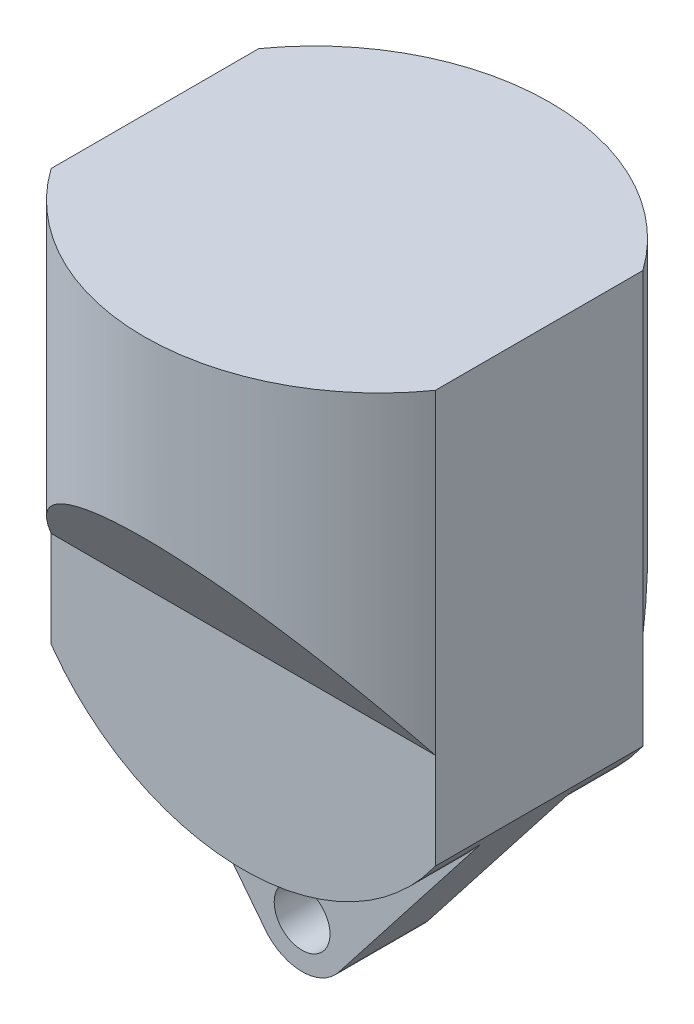
from build123d import *

# Parameters (mm, degrees)
EXTRUDE_1_DEPTH     = 67
SKETCH_2_OUTSIDE_W  = 175.426
SKETCH_2_OUTSIDE_H  = 254.426
CUT_EXTRUDE_1_DEPTH = 19
SKETCH_4_OUTSIDE_W  = 175.426
SKETCH_4_OUTSIDE_H  = 254.426
CUT_EXTRUDE_2_DEPTH = 19
EXTRUDE_2_DEPTH     = 102
CUT_EXTRUDE_3_DEPTH = 247.010162392
SKETCH_7_R          = 9
CUT_EXTRUDE_4_DEPTH = 214.513465618


with BuildPart() as part:
    # Эскиз1 → Бобышка-Вытянуть1 (new body)
    with BuildSketch(Plane.XY):
        with BuildLine():
            Line((-62, 55), (-62, 188))
            Line((-62, 188), (62, 188))
            Line((62, 188), (62, 55))
            Line((62, 55), (12.047963129, -8.935691604))
            ThreePointArc((12.047963129, -8.935691604), (0, -15), (-12.047963129, -8.935691604))
            Line((-12.047963129, -8.935691604), (-62, 55))
        make_face()
    extrude(amount=EXTRUDE_1_DEPTH)

    # Эскиз2 outside → Вырез-Вытянуть1 (cut)
    with BuildSketch(Plane.XY.offset(67)):
        with Locations((0, 86.5)):
            Rectangle(SKETCH_2_OUTSIDE_W, SKETCH_2_OUTSIDE_H)
        with BuildLine():
            Line((-62, 55), (-62, 188))
            Line((-62, 188), (62, 188))
            Line((62, 188), (62, 55))
            ThreePointArc((62, 55), (0, 23), (-62, 55))
        make_face(mode=Mode.SUBTRACT)
    extrude(amount=-CUT_EXTRUDE_1_DEPTH, mode=Mode.SUBTRACT)

    # Эскиз4 outside → Вырез-Вытянуть2 (cut)
    with BuildSketch(Plane(origin=(0, 0, 0), x_dir=(-1, 0, 0), z_dir=(0, 0, -1))):
        with Locations((0, 86.5)):
            Rectangle(SKETCH_4_OUTSIDE_W, SKETCH_4_OUTSIDE_H)
        with BuildLine():
            Line((-62, 55), (-62, 188))
            Line((-62, 188), (62, 188))
            Line((62, 188), (62, 55))
            ThreePointArc((62, 55), (0, 23), (-62, 55))
        make_face(mode=Mode.SUBTRACT)
    extrude(amount=-CUT_EXTRUDE_2_DEPTH, mode=Mode.SUBTRACT)

    # Эскиз5 → Бобышка-Вытянуть2 (add)
    with BuildSketch(Plane(origin=(0, 188, 0), x_dir=(1, 0, 0), z_dir=(0, 1, 0))):
        with BuildLine():
            Line((-62, 0), (62, 0))
            ThreePointArc((62, 0), (0, 32), (-62, 0))
        make_face()
        with BuildLine():
            Line((-62, -67), (62, -67))
            ThreePointArc((62, -67), (0, -99), (-62, -67))
        make_face()
    extrude(amount=-EXTRUDE_2_DEPTH)

    # Эскиз6 → Вырез-Вытянуть3 (cut, through all)
    with BuildSketch(Plane(origin=(62, 0, 0), x_dir=(0, 0, -1), z_dir=(1, 0, 0))):
        Polygon((0, 86), (32, 131.700736216), (32, 86), align=None)
        Polygon((-67, 86), (-99, 131.700736216), (-99, 86), align=None)
    extrude(amount=-CUT_EXTRUDE_3_DEPTH, mode=Mode.SUBTRACT)

    # Эскиз7 → Вырез-Вытянуть4 (cut, through all)
    with BuildSketch(Plane(origin=(0, 0, 19), x_dir=(-1, 0, 0), z_dir=(0, 0, -1))):
        Circle(SKETCH_7_R)
    extrude(amount=-CUT_EXTRUDE_4_DEPTH, mode=Mode.SUBTRACT)


solid = part.part
